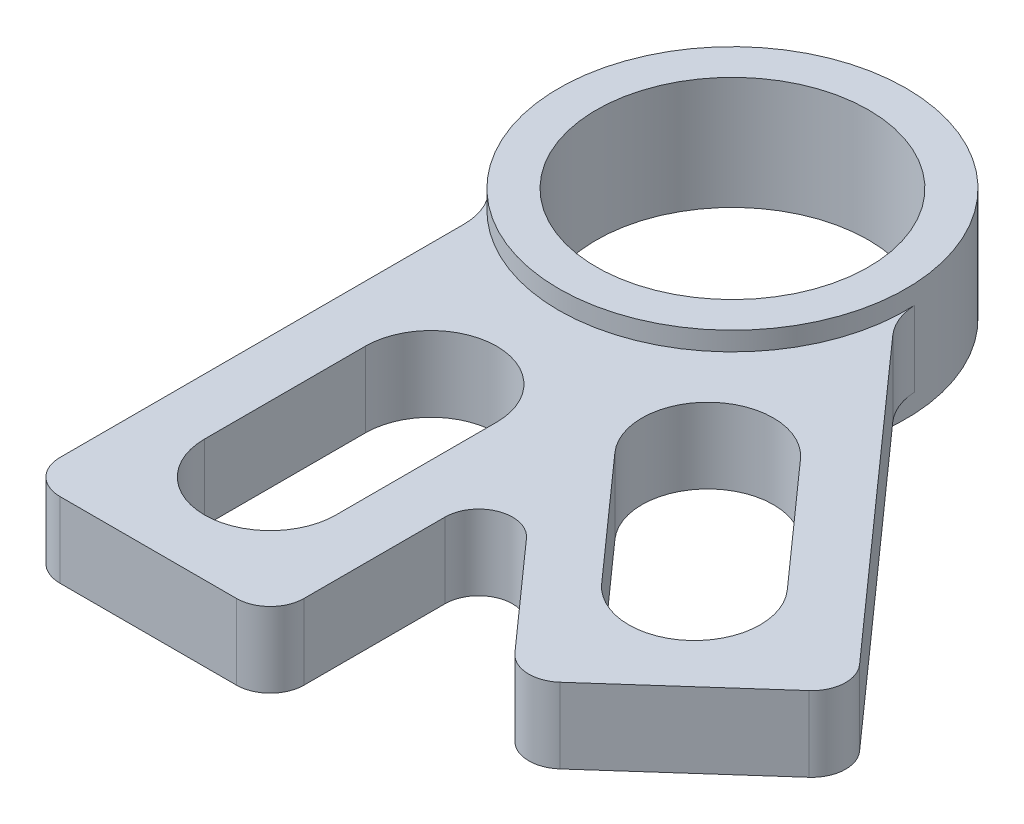
from build123d import *

# Parameters (mm, degrees)
SKETCH1_R                      = 14.6812
SKETCH1_R_2                    = 11.5062
BEARING_INSERT_EXTRUDE_DEPTH   = 4.7625
APEX_SLOT_INSERT_EXTRUDE_DEPTH = 3.175
FILLET1_R                      = 5.08
FILLET2_R                      = 2.8575


with BuildPart() as part:
    # Sketch1 → Bearing_Insert_Extrude (new, symmetric)
    with BuildSketch(Plane(origin=(0, 0, 0), x_dir=(1, 0, 0), z_dir=(0, 1, 0))):
        with Locations(Location((0, 0, 0), (0, 0, 90))):
            Circle(SKETCH1_R)
        with Locations(Location((0, 0, 0), (0, 0, 90))):
            Circle(SKETCH1_R_2, mode=Mode.SUBTRACT)
    extrude(amount=BEARING_INSERT_EXTRUDE_DEPTH, both=True)

    # Sketch1<4> → Apex_Slot_Insert_Extrude (add, symmetric)
    with BuildSketch(Plane(origin=(0, 0, 0), x_dir=(1, 0, 0), z_dir=(0, 1, 0))):
        with BuildLine():
            Line((-10.31875, -10.443228997), (-10.31875, -49.3903))
            Line((-10.31875, -49.3903), (10.31875, -49.3903))
            Line((10.31875, -49.3903), (10.31875, -27.114771747))
            Line((10.31875, -27.114771747), (25.128243321, -43.754425185))
            Line((25.128243321, -43.754425185), (40.544301873, -30.033946149))
            Line((40.544301873, -30.033946149), (14.651026466, -0.94077464))
            ThreePointArc((14.651026466, -0.94077464), (5.221715671, -13.721199616), (-10.31875, -10.443228997))
        make_face()
        with BuildLine():
            ThreePointArc((5.55625, -39.07155), (0, -44.6278), (-5.55625, -39.07155))
            Line((-5.55625, -39.07155), (-5.55625, -25.48255))
            ThreePointArc((-5.55625, -25.48255), (0, -19.9263), (5.55625, -25.48255))
            Line((5.55625, -25.48255), (5.55625, -39.07155))
        make_face(mode=Mode.SUBTRACT)
        with BuildLine():
            ThreePointArc((30.126510381, -25.492181266), (29.670008204, -33.336633694), (21.825555776, -32.880131516))
            Line((21.825555776, -32.880131516), (12.791148042, -22.729249885))
            ThreePointArc((12.791148042, -22.729249885), (13.24765022, -14.884797457), (21.092102647, -15.341299635))
            Line((21.092102647, -15.341299635), (30.126510381, -25.492181266))
        make_face(mode=Mode.SUBTRACT)
    extrude(amount=APEX_SLOT_INSERT_EXTRUDE_DEPTH, both=True)

    # Fillet1
    fillet1_edges = [part.edges().sort_by_distance(p)[0] for p in [
        (14.651026466, 0, 0.94077464),
        (-10.31875, 0, 10.443228997),
    ]]
    fillet(fillet1_edges, radius=FILLET1_R)

    # Fillet2
    fillet2_edges = [part.edges().sort_by_distance(p)[0] for p in [
        (-10.31875, 0, 49.3903),
        (10.31875, 0, 49.3903),
        (10.31875, 0, 27.114771747),
        (25.128243321, 0, 43.754425185),
        (40.544301873, 0, 30.033946149),
    ]]
    fillet(fillet2_edges, radius=FILLET2_R)


solid = part.part
